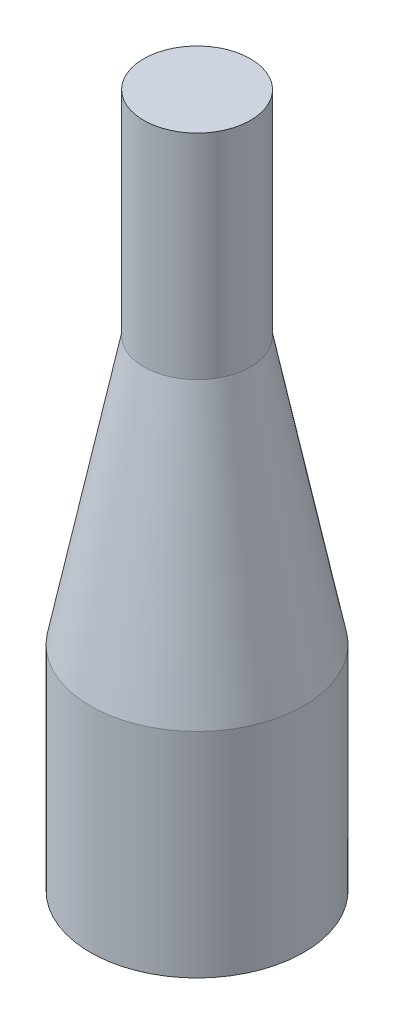
from build123d import *


with BuildPart() as part:
    # Sketch1 → Revolve1 (revolve)
    with BuildSketch(Plane.XY, mode=Mode.PRIVATE) as revolve1_sk:
        Polygon((0, 0), (0, 101.6), (-25.4, 228.6), (-25.4, 330.2), (-50.8, 330.2), (-50.8, 0), align=None)
    revolve(revolve1_sk.sketch.rotate(Axis((-50.8, 0, 0), (0, 1, 0)), 90), axis=Axis((-50.8, 0, 0), (0, 1, 0)))


solid = part.part
